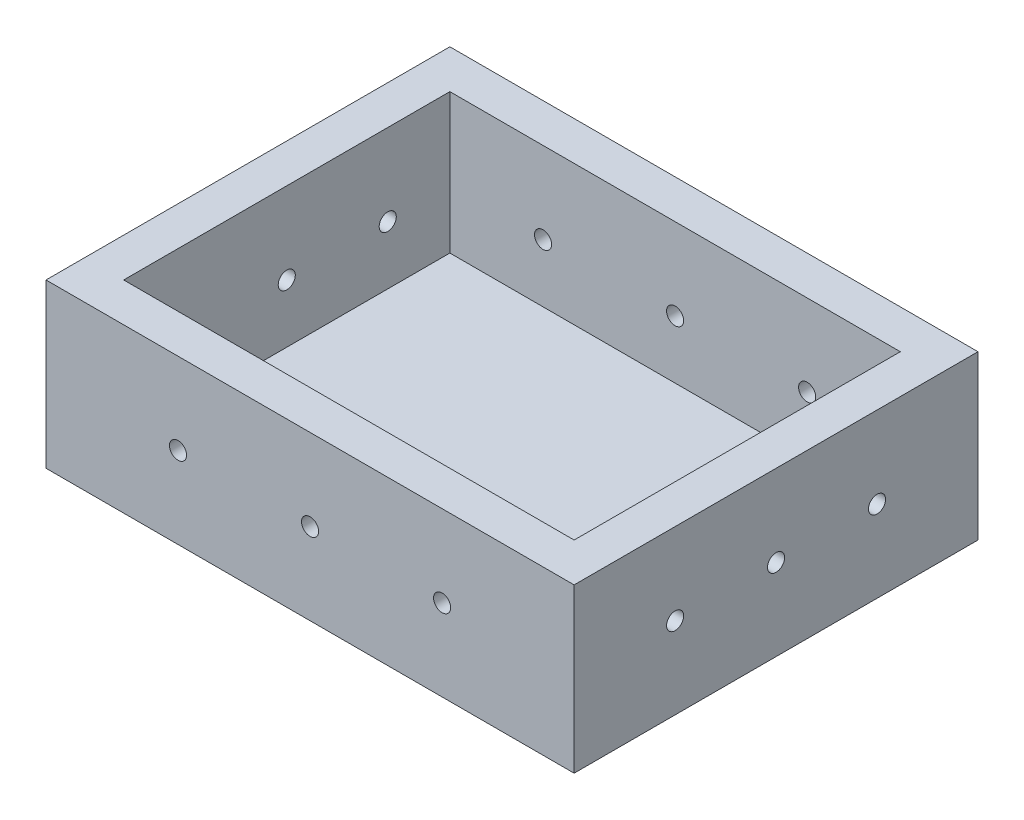
from build123d import *

# Parameters (mm, degrees)
SKETCH_1_W          = 136
SKETCH_1_H          = 104
EXTRUDE_1_DEPTH     = 42
SKETCH_2_W          = 116
SKETCH_2_H          = 84
CUT_EXTRUDE_1_DEPTH = 36
SKETCH_6_R          = 2.2
CUT_EXTRUDE_5_DEPTH = 136
SKETCH_7_R          = 2.2
CUT_EXTRUDE_6_DEPTH = 104


with BuildPart() as part:
    # 草图1 → 凸台-拉伸1 (new body)
    with BuildSketch(Plane(origin=(0, 0, 0), x_dir=(1, 0, 0), z_dir=(0, 1, 0))):
        Rectangle(SKETCH_1_W, SKETCH_1_H)
    extrude(amount=EXTRUDE_1_DEPTH)

    # 草图2 → 切除-拉伸1 (cut)
    with BuildSketch(Plane(origin=(0, 42, 0), x_dir=(1, 0, 0), z_dir=(0, 1, 0))):
        Rectangle(SKETCH_2_W, SKETCH_2_H)
    extrude(amount=-CUT_EXTRUDE_1_DEPTH, mode=Mode.SUBTRACT)

    # 草图6 → 切除-拉伸5 (cut)
    with BuildSketch(Plane.ZY.offset(68)):
        with Locations((-26, 21)):
            Circle(SKETCH_6_R)
        with Locations((26, 21)):
            Circle(SKETCH_6_R)
        with Locations((0, 21)):
            Circle(SKETCH_6_R)
    extrude(amount=-CUT_EXTRUDE_5_DEPTH, mode=Mode.SUBTRACT)

    # 草图7 → 切除-拉伸6 (cut)
    with BuildSketch(Plane(origin=(0, 0, -52), x_dir=(-1, 0, 0), z_dir=(0, 0, -1))):
        with Locations((-34, 21)):
            Circle(SKETCH_7_R)
        with Locations((34, 21)):
            Circle(SKETCH_7_R)
        with Locations((0, 21)):
            Circle(SKETCH_7_R)
    extrude(amount=-CUT_EXTRUDE_6_DEPTH, mode=Mode.SUBTRACT)


solid = part.part
